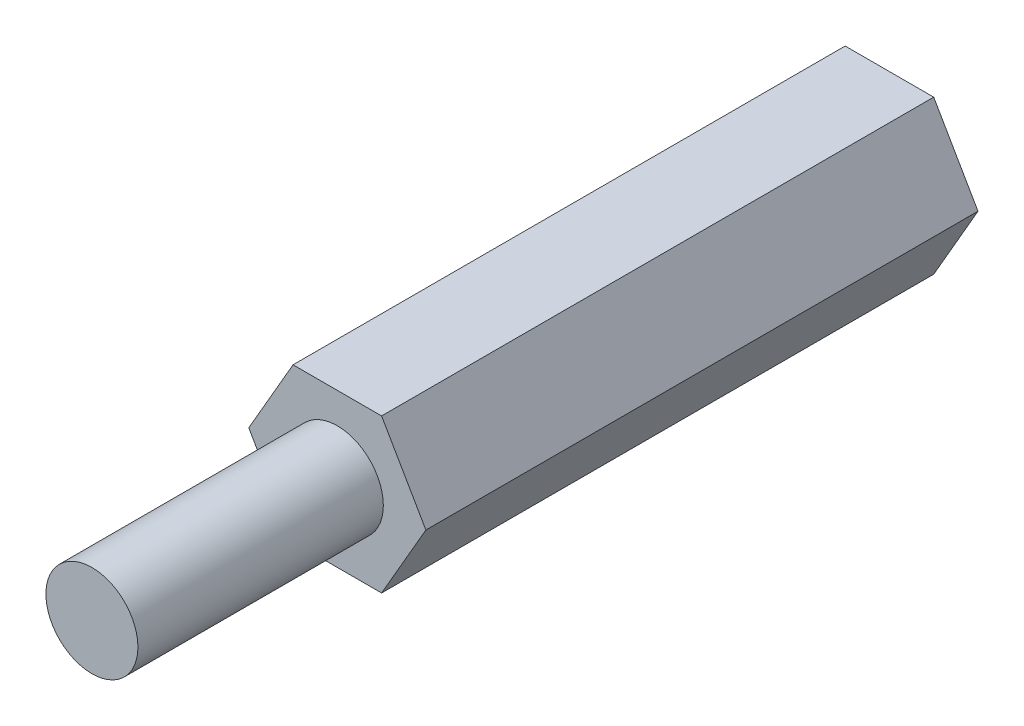
from build123d import *

# Parameters (mm, degrees)
BOSS_EXTRUDE1_DEPTH       = 18
SKETCH2_R                 = 1.5
BOSS_EXTRUDE2_DEPTH       = 8
M3X0_5_TAPPED_HOLE1_D     = 2.5
M3X0_5_TAPPED_HOLE1_DEPTH = 8
M3X0_5_TAPPED_HOLE1_TIP   = 0.751075774


with BuildPart() as part:
    # Sketch1 → Boss-Extrude1 (new body)
    with BuildSketch(Plane.XY):
        Polygon((-1.443375673, 2.5), (-2.886751346, 0), (-1.443375673, -2.5), (1.443375673, -2.5), (2.886751346, 0), (1.443375673, 2.5), align=None)
    extrude(amount=BOSS_EXTRUDE1_DEPTH)

    # Sketch2 → Boss-Extrude2 (add)
    with BuildSketch(Plane.XY.offset(18)):
        Circle(SKETCH2_R)
    extrude(amount=BOSS_EXTRUDE2_DEPTH)

    # M3x0.5 Tapped Hole1
    with Locations(Plane(origin=(0, 0, 0), x_dir=(-1, 0, 0), z_dir=(0, 0, -1))):
        with Locations((0, 0)):
            Hole(M3X0_5_TAPPED_HOLE1_D / 2, depth=M3X0_5_TAPPED_HOLE1_DEPTH)
            with Locations((0, 0, -(M3X0_5_TAPPED_HOLE1_DEPTH + M3X0_5_TAPPED_HOLE1_TIP / 2))):  # 118° drill point
                Cone(0, M3X0_5_TAPPED_HOLE1_D / 2, M3X0_5_TAPPED_HOLE1_TIP, mode=Mode.SUBTRACT)


solid = part.part
